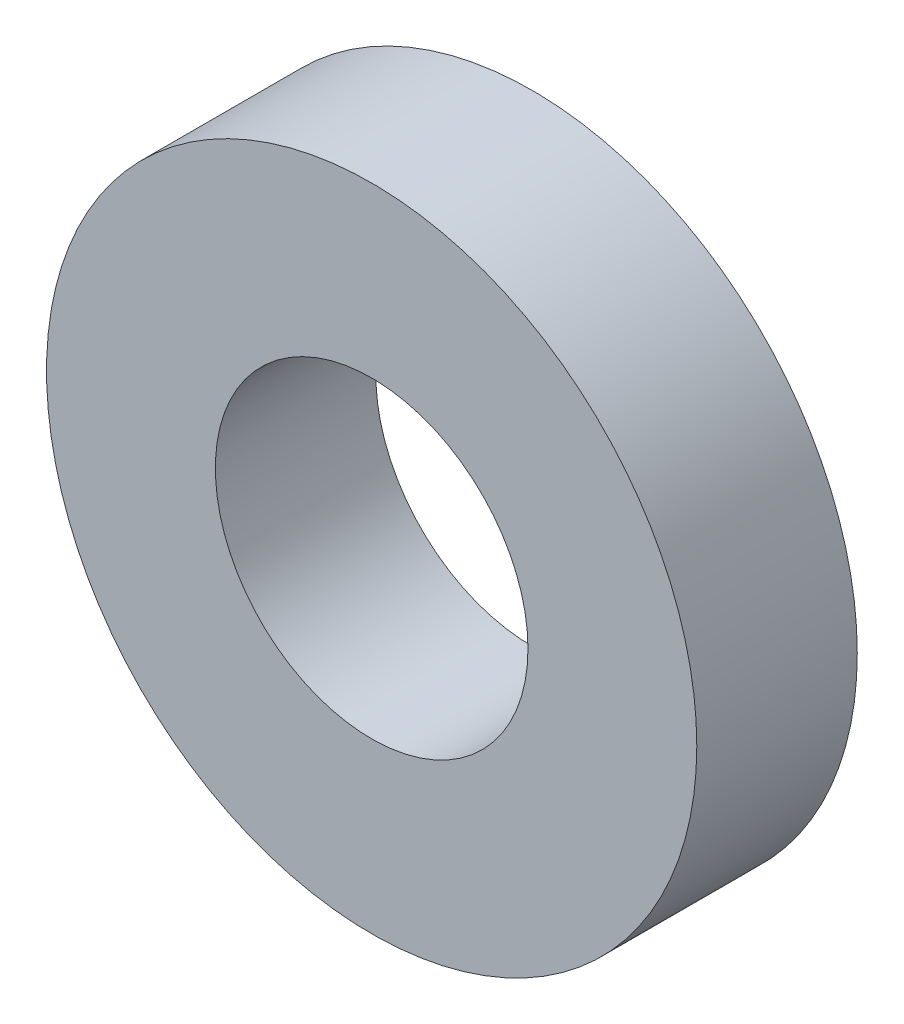
from build123d import *

# Parameters (mm, degrees)
SKETCH1_R      = 3.9624
SKETCH1_R_2    = 1.905
EXTRUDE1_DEPTH = 1.9558


with BuildPart() as part:
    # Sketch1 → Extrude1 (new body)
    with BuildSketch(Plane.XY):
        Circle(SKETCH1_R)
        Circle(SKETCH1_R_2, mode=Mode.SUBTRACT)
    extrude(amount=-EXTRUDE1_DEPTH)


solid = part.part
